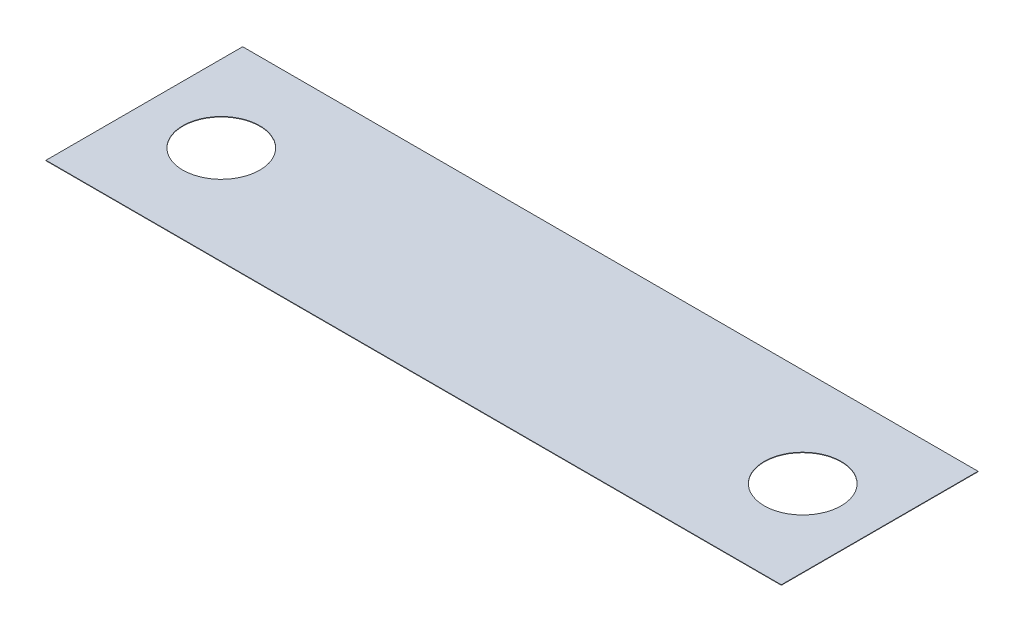
from build123d import *

# Parameters (mm, degrees)
SKETCH1_W                = 86
SKETCH1_H                = 23
EXTRUDE1_DEPTH           = 0.0508
F_9_0_9_DIAMETER_HOLE1_D = 9


with BuildPart() as part:
    # Sketch1 → Extrude1 (new body)
    with BuildSketch(Plane(origin=(0, 0, 0), x_dir=(1, 0, 0), z_dir=(0, 1, 0))):
        with Locations((43, 11.5)):
            Rectangle(SKETCH1_W, SKETCH1_H)
    extrude(amount=EXTRUDE1_DEPTH)

    # Ø9.0 (9) Diameter Hole1 (through all)
    with Locations(Plane(origin=(0, 0.0508, 0), x_dir=(-1, 0, 0), z_dir=(0, 1, 0))):
        with Locations((-9, -11.5), (-77, -11.5)):
            Hole(F_9_0_9_DIAMETER_HOLE1_D / 2)


solid = part.part
